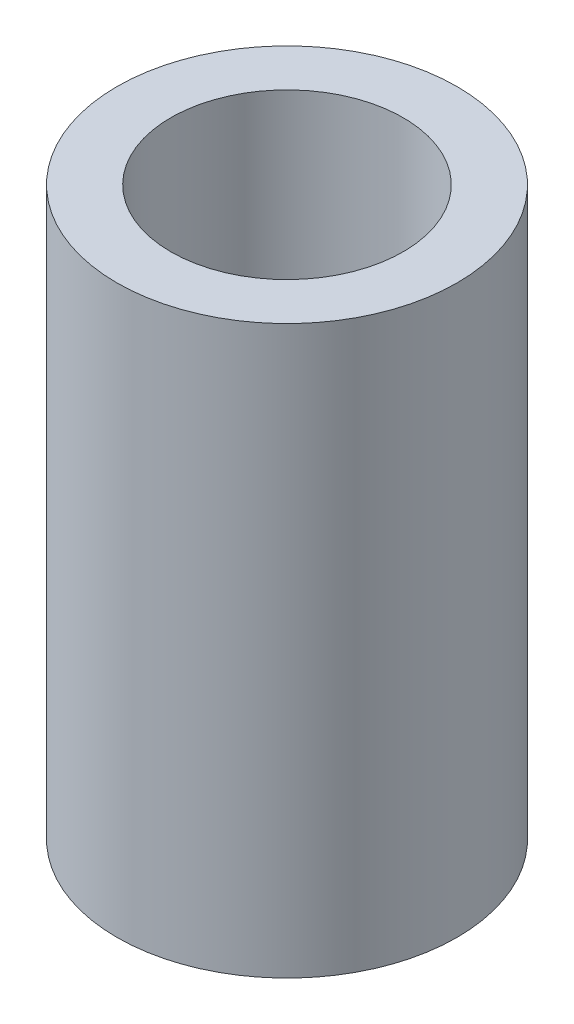
from build123d import *

# Parameters (mm, degrees)
SKETCH_1_R      = 3
SKETCH_1_R_2    = 2.05
EXTRUDE_1_DEPTH = 10


with BuildPart() as part:
    # 草圖1 → 填料-伸長1 (new body)
    with BuildSketch(Plane(origin=(0, 0, 0), x_dir=(1, 0, 0), z_dir=(0, 1, 0))):
        with Locations(Location((0, 0, 0), (0, 0, 270))):
            Circle(SKETCH_1_R)
        with Locations(Location((0, 0, 0), (0, 0, 270))):
            Circle(SKETCH_1_R_2, mode=Mode.SUBTRACT)
    extrude(amount=EXTRUDE_1_DEPTH)


solid = part.part
